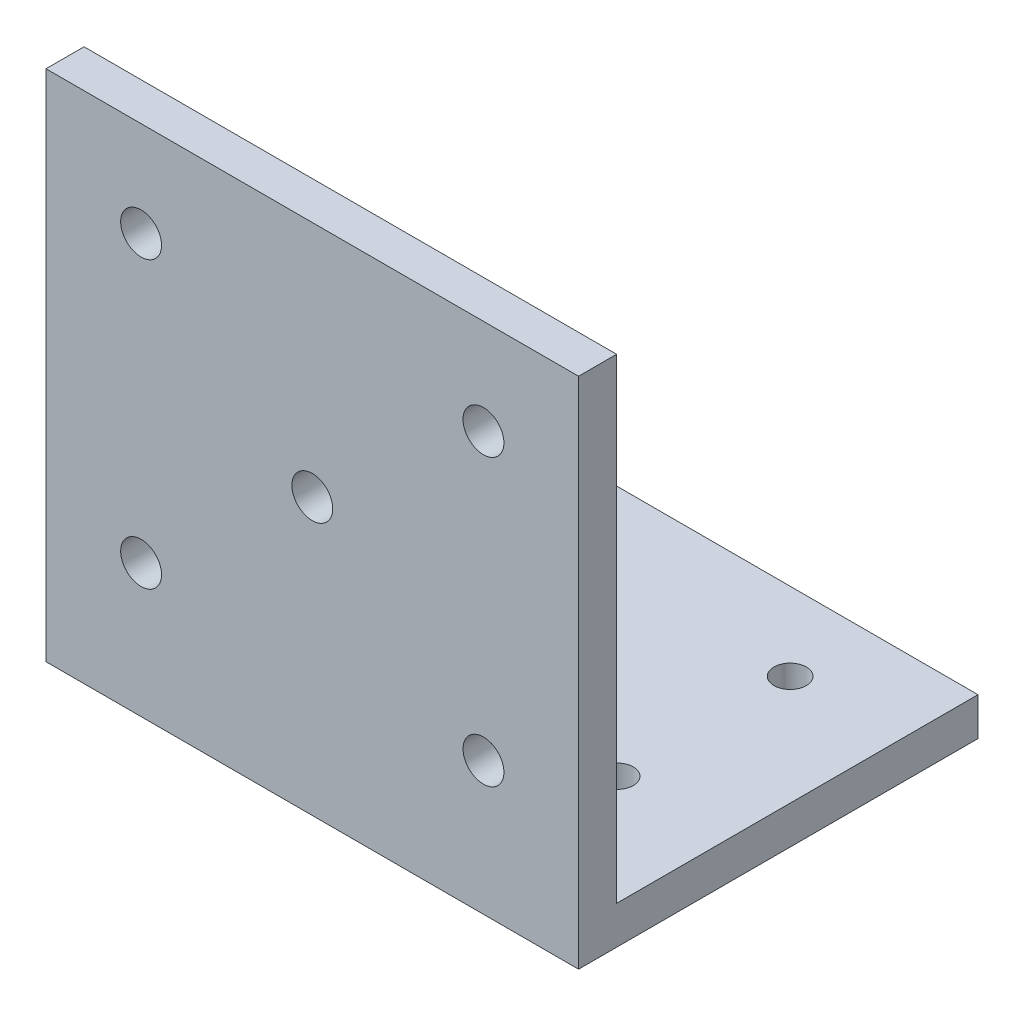
from build123d import *

# Parameters (mm, degrees)
SKETCH_2_W          = 56
SKETCH_2_H          = 4
EXTRUDE_1_DEPTH     = 54
SKETCH_2_3_W        = 56
SKETCH_2_3_H        = 38
EXTRUDE_2_DEPTH     = 4
SKETCH_3_R          = 2.15
CUT_EXTRUDE_1_DEPTH = 4
SKETCH_4_R          = 1.7
SKETCH_4_R_2        = 7.2
CUT_EXTRUDE_3_DEPTH = 10


with BuildPart() as part:
    # 草图2 → 凸台-拉伸1 (new body)
    with BuildSketch(Plane(origin=(0, 0, 0), x_dir=(1, 0, 0), z_dir=(0, 1, 0))):
        with Locations((-6.312292359, -27.209302326)):
            Rectangle(SKETCH_2_W, SKETCH_2_H)
    extrude(amount=EXTRUDE_1_DEPTH)

    # 草图2<3> → 凸台-拉伸2 (add)
    with BuildSketch(Plane(origin=(0, 0, 0), x_dir=(1, 0, 0), z_dir=(0, 1, 0))):
        with Locations((-6.312292359, -6.209302326)):
            Rectangle(SKETCH_2_3_W, SKETCH_2_3_H)
    extrude(amount=EXTRUDE_2_DEPTH)

    # 草图3 → 切除-拉伸1 (cut)
    with BuildSketch(Plane(origin=(0, 0, 25.209302326), x_dir=(-1, 0, 0), z_dir=(0, 0, -1))):
        with Locations((6.312292359, 29)):
            Circle(SKETCH_3_R)
        with Locations((-11.687707641, 44)):
            Circle(SKETCH_3_R)
        with Locations((24.312292359, 44)):
            Circle(SKETCH_3_R)
        with Locations((24.312292359, 14)):
            Circle(SKETCH_3_R)
        with Locations((-11.687707641, 14)):
            Circle(SKETCH_3_R)
    extrude(amount=-CUT_EXTRUDE_1_DEPTH, mode=Mode.SUBTRACT)

    # 草图4 → 切除-拉伸3 (cut)
    with BuildSketch(Plane(origin=(0, 4, 0), x_dir=(1, 0, 0), z_dir=(0, 1, 0))):
        with Locations((-22.762292359, -13.609302326)):
            Circle(SKETCH_4_R)
        with Locations((-22.762292359, 4.590697674)):
            Circle(SKETCH_4_R)
        with Locations((-14.512292359, -4.509302326)):
            Circle(SKETCH_4_R_2)
        with Locations((10.137707641, 4.590697674)):
            Circle(SKETCH_4_R)
        with Locations((10.137707641, -13.609302326)):
            Circle(SKETCH_4_R)
    extrude(amount=-CUT_EXTRUDE_3_DEPTH, mode=Mode.SUBTRACT)


solid = part.part
